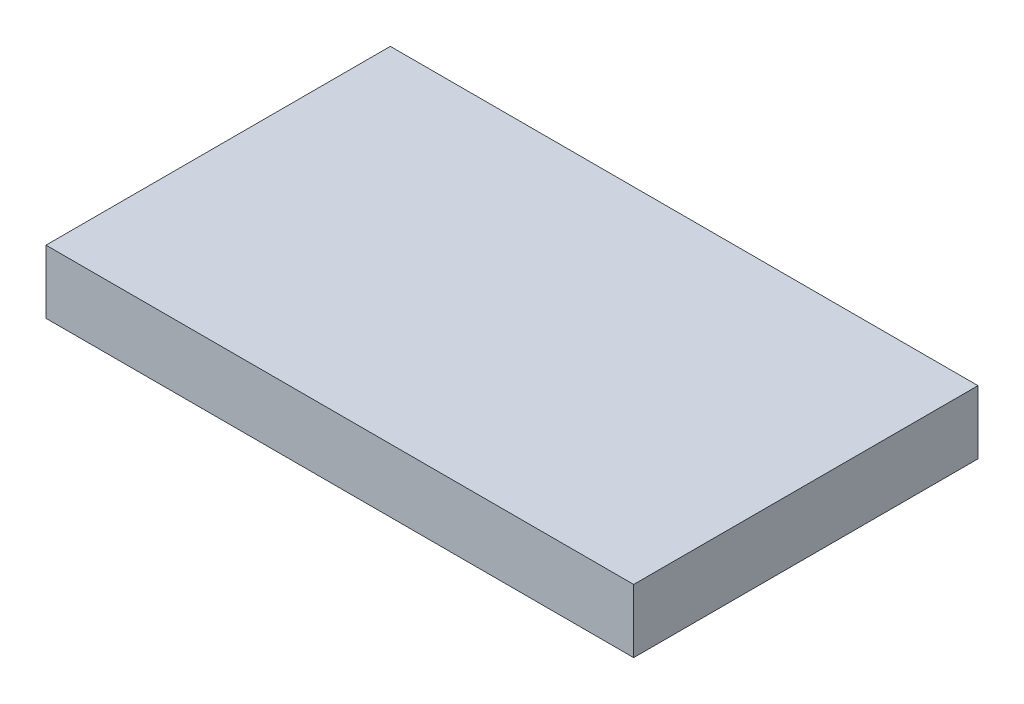
from build123d import *

# Parameters (mm, degrees)
SKETCH1_W           = 58.85
SKETCH1_H           = 34.48
BOSS_EXTRUDE1_DEPTH = 6.35


with BuildPart() as part:
    # Sketch1 → Boss-Extrude1 (new body)
    with BuildSketch(Plane(origin=(0, 0, 0), x_dir=(1, 0, 0), z_dir=(0, 1, 0))):
        Rectangle(SKETCH1_W, SKETCH1_H)
    extrude(amount=BOSS_EXTRUDE1_DEPTH)


solid = part.part
